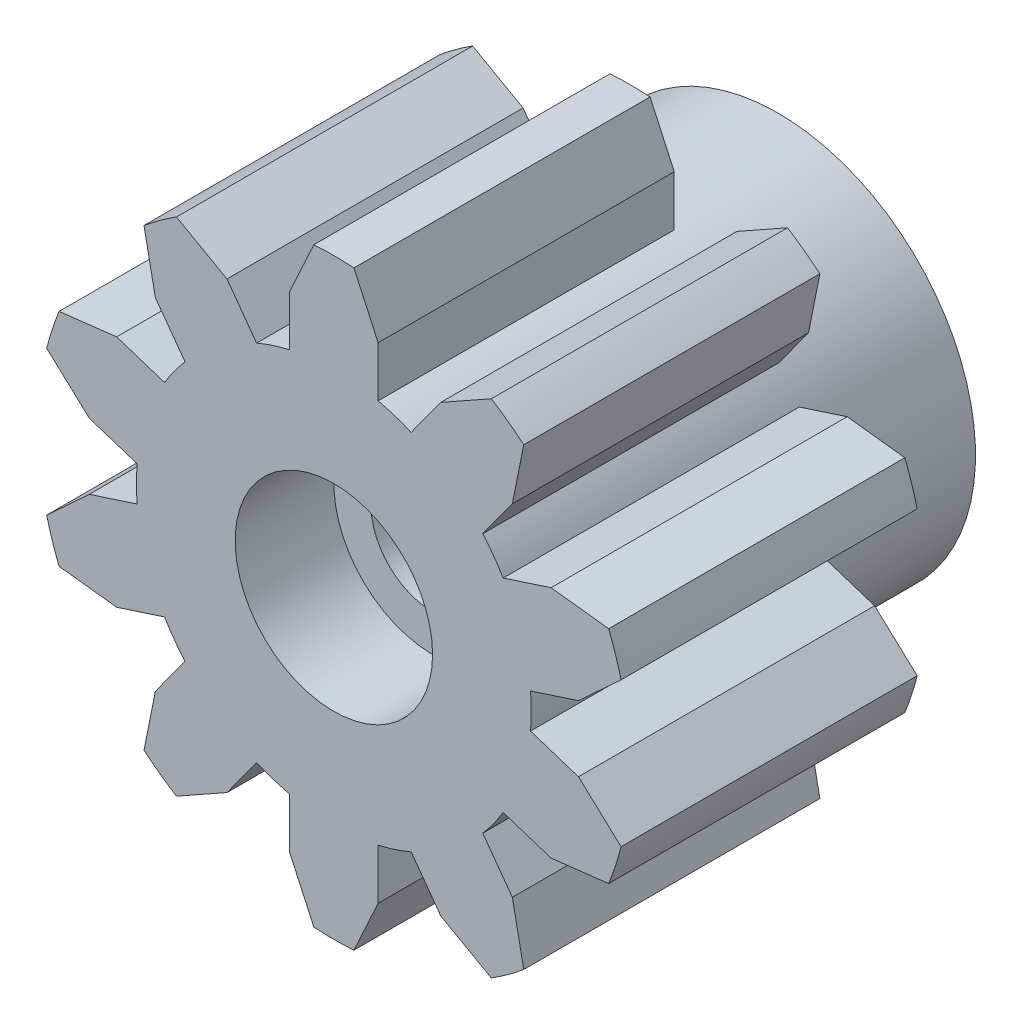
from build123d import *

# Parameters (mm, degrees)
SKETCH_1_W                   = 4
SKETCH_1_H                   = 9
EXTRUDE_1_DEPTH              = 6
EXTRUDE_2_DEPTH              = 6
EXTRUDE_3_DEPTH              = 6
EXTRUDE_4_DEPTH              = 6
EXTRUDE_5_DEPTH              = 6
EXTRUDE_6_DEPTH              = 6
EXTRUDE_7_DEPTH              = 6
EXTRUDE_8_DEPTH              = 6
EXTRUDE_9_DEPTH              = 6
EXTRUDE_10_DEPTH             = 6
HOLE_WIZARD_M2_1_D           = 2.5
HOLE_WIZARD_M2_1_CBORE_D     = 4
HOLE_WIZARD_M2_1_CBORE_DEPTH = 2


with BuildPart() as part:
    # 草图1 → 旋转1 (revolve)
    with BuildSketch(Plane.XZ, mode=Mode.PRIVATE) as revolve_1_sk:
        with Locations((2, 1.5)):
            Rectangle(SKETCH_1_W, SKETCH_1_H)
    revolve(revolve_1_sk.sketch.rotate(Axis((0, 0, 6), (0, 0, -1)), 180), axis=Axis((0, 0, 6), (0, 0, -1)))

    # 草图2 → 凸台-拉伸1 (add)
    with BuildSketch(Plane.XY.offset(6)):
        with BuildLine():
            Line((3.984468068, 0.352156525), (4.955233641, 0.66757738))
            Line((4.955233641, 0.66757738), (5.818800307, 1.463408004))
            ThreePointArc((5.818800307, 1.463408004), (5.706339098, 1.854101966), (5.567677978, 2.236283062))
            Line((5.567677978, 2.236283062), (4.401260366, 2.372531811))
            Line((4.401260366, 2.372531811), (3.430494792, 2.057110955))
            ThreePointArc((3.430494792, 2.057110955), (3.804226065, 1.236067977), (3.984468068, 0.352156525))
        make_face()
    extrude(amount=-EXTRUDE_1_DEPTH)

    # 草图3 → 凸台-拉伸2 (add)
    with BuildSketch(Plane.XY.offset(6)):
        with BuildLine():
            Line((3.016509969, 2.626912182), (3.616476088, 3.452694702))
            Line((3.616476088, 3.452694702), (3.847338693, 4.604126951))
            ThreePointArc((3.847338693, 4.604126951), (3.526711514, 4.854101966), (3.1898919, 5.081790006))
            Line((3.1898919, 5.081790006), (2.166155224, 4.506414489))
            Line((2.166155224, 4.506414489), (1.566189104, 3.680631969))
            ThreePointArc((1.566189104, 3.680631969), (2.351141009, 3.236067977), (3.016509969, 2.626912182))
        make_face()
    extrude(amount=-EXTRUDE_2_DEPTH)

    # 草图4 → 凸台-拉伸3 (add)
    with BuildSketch(Plane.XY.offset(6)):
        with BuildLine():
            Line((0.896347589, 3.898276671), (0.896347589, 4.919))
            Line((0.896347589, 4.919), (0.406324464, 5.986225892))
            ThreePointArc((0.406324464, 5.986225892), (0, 6), (-0.406324464, 5.986225892))
            Line((-0.406324464, 5.986225892), (-0.896347589, 4.919))
            Line((-0.896347589, 4.919), (-0.896347589, 3.898276671))
            ThreePointArc((-0.896347589, 3.898276671), (0, 4), (0.896347589, 3.898276671))
        make_face()
    extrude(amount=-EXTRUDE_3_DEPTH)

    # 草图5 → 凸台-拉伸4 (add)
    with BuildSketch(Plane.XY.offset(6)):
        with BuildLine():
            Line((-1.566189104, 3.680631969), (-2.166155224, 4.506414489))
            Line((-2.166155224, 4.506414489), (-3.1898919, 5.081790006))
            ThreePointArc((-3.1898919, 5.081790006), (-3.526711514, 4.854101966), (-3.847338693, 4.604126951))
            Line((-3.847338693, 4.604126951), (-3.616476088, 3.452694702))
            Line((-3.616476088, 3.452694702), (-3.016509969, 2.626912182))
            ThreePointArc((-3.016509969, 2.626912182), (-2.351141009, 3.236067977), (-1.566189104, 3.680631969))
        make_face()
    extrude(amount=-EXTRUDE_4_DEPTH)

    # 草图6 → 凸台-拉伸5 (add)
    with BuildSketch(Plane.XY.offset(6)):
        with BuildLine():
            Line((-3.430494792, 2.057110955), (-4.401260366, 2.372531811))
            Line((-4.401260366, 2.372531811), (-5.567677978, 2.236283062))
            ThreePointArc((-5.567677978, 2.236283062), (-5.706339098, 1.854101966), (-5.818800307, 1.463408004))
            Line((-5.818800307, 1.463408004), (-4.955233641, 0.66757738))
            Line((-4.955233641, 0.66757738), (-3.984468068, 0.352156525))
            ThreePointArc((-3.984468068, 0.352156525), (-3.804226065, 1.236067977), (-3.430494792, 2.057110955))
        make_face()
    extrude(amount=-EXTRUDE_5_DEPTH)

    # 草图7 → 凸台-拉伸6 (add)
    with BuildSketch(Plane.XY.offset(6)):
        with BuildLine():
            Line((-3.984468068, -0.352156525), (-4.955233641, -0.66757738))
            Line((-4.955233641, -0.66757738), (-5.818800307, -1.463408004))
            ThreePointArc((-5.818800307, -1.463408004), (-5.706339098, -1.854101966), (-5.567677978, -2.236283062))
            Line((-5.567677978, -2.236283062), (-4.401260366, -2.372531811))
            Line((-4.401260366, -2.372531811), (-3.430494792, -2.057110955))
            ThreePointArc((-3.430494792, -2.057110955), (-3.804226065, -1.236067977), (-3.984468068, -0.352156525))
        make_face()
    extrude(amount=-EXTRUDE_6_DEPTH)

    # 草图8 → 凸台-拉伸7 (add)
    with BuildSketch(Plane.XY.offset(6)):
        with BuildLine():
            Line((-3.016509969, -2.626912182), (-3.616476088, -3.452694702))
            Line((-3.616476088, -3.452694702), (-3.847338693, -4.604126951))
            ThreePointArc((-3.847338693, -4.604126951), (-3.526711514, -4.854101966), (-3.1898919, -5.081790006))
            Line((-3.1898919, -5.081790006), (-2.166155224, -4.506414489))
            Line((-2.166155224, -4.506414489), (-1.566189104, -3.680631969))
            ThreePointArc((-1.566189104, -3.680631969), (-2.351141009, -3.236067977), (-3.016509969, -2.626912182))
        make_face()
    extrude(amount=-EXTRUDE_7_DEPTH)

    # 草图9 → 凸台-拉伸8 (add)
    with BuildSketch(Plane.XY.offset(6)):
        with BuildLine():
            Line((-0.896347589, -3.898276671), (-0.896347589, -4.919))
            Line((-0.896347589, -4.919), (-0.406324464, -5.986225892))
            ThreePointArc((-0.406324464, -5.986225892), (0, -6), (0.406324464, -5.986225892))
            Line((0.406324464, -5.986225892), (0.896347589, -4.919))
            Line((0.896347589, -4.919), (0.896347589, -3.898276671))
            ThreePointArc((0.896347589, -3.898276671), (0, -4), (-0.896347589, -3.898276671))
        make_face()
    extrude(amount=-EXTRUDE_8_DEPTH)

    # 草图10 → 凸台-拉伸9 (add)
    with BuildSketch(Plane.XY.offset(6)):
        with BuildLine():
            Line((1.566189104, -3.680631969), (2.166155224, -4.506414489))
            Line((2.166155224, -4.506414489), (3.1898919, -5.081790006))
            ThreePointArc((3.1898919, -5.081790006), (3.526711514, -4.854101966), (3.847338693, -4.604126951))
            Line((3.847338693, -4.604126951), (3.616476088, -3.452694702))
            Line((3.616476088, -3.452694702), (3.016509969, -2.626912182))
            ThreePointArc((3.016509969, -2.626912182), (2.351141009, -3.236067977), (1.566189104, -3.680631969))
        make_face()
    extrude(amount=-EXTRUDE_9_DEPTH)

    # 草图11 → 凸台-拉伸10 (add)
    with BuildSketch(Plane.XY.offset(6)):
        with BuildLine():
            Line((3.430494792, -2.057110955), (4.401260366, -2.372531811))
            Line((4.401260366, -2.372531811), (5.567677978, -2.236283062))
            ThreePointArc((5.567677978, -2.236283062), (5.706339098, -1.854101966), (5.818800307, -1.463408004))
            Line((5.818800307, -1.463408004), (4.955233641, -0.66757738))
            Line((4.955233641, -0.66757738), (3.984468068, -0.352156525))
            ThreePointArc((3.984468068, -0.352156525), (3.804226065, -1.236067977), (3.430494792, -2.057110955))
        make_face()
    extrude(amount=-EXTRUDE_10_DEPTH)

    # M2 六角头机械螺钉的柱形沉头孔1 (through all)
    with Locations(Plane.XY.offset(6)):
        with Locations((0, 0)):
            CounterBoreHole(HOLE_WIZARD_M2_1_D / 2, HOLE_WIZARD_M2_1_CBORE_D / 2, HOLE_WIZARD_M2_1_CBORE_DEPTH)


solid = part.part
